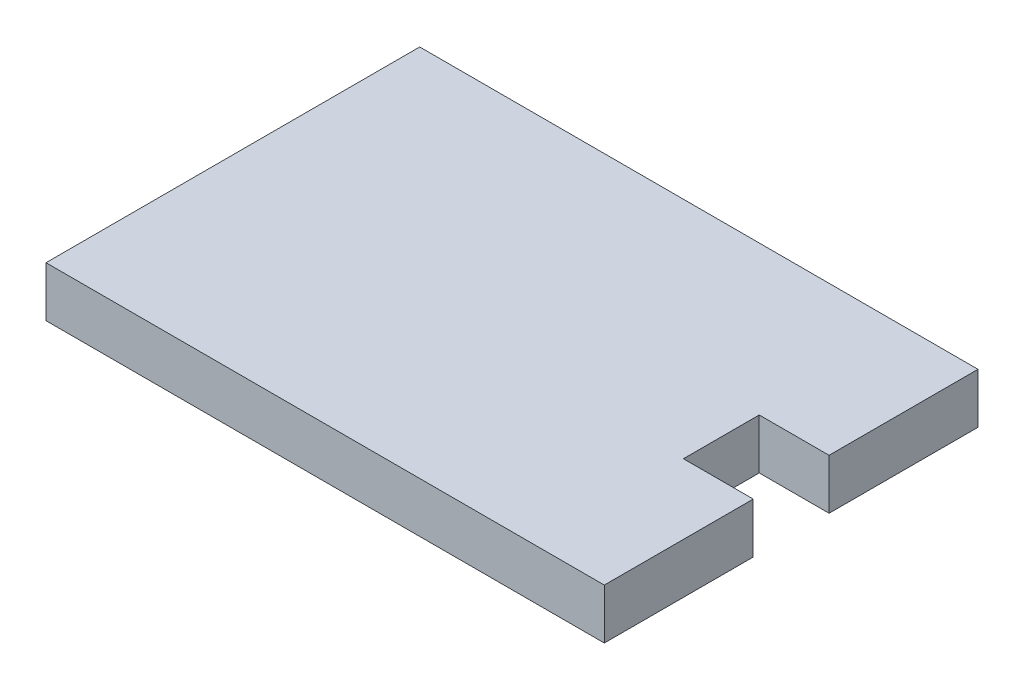
from build123d import *

# Parameters (mm, degrees)
EXTRUDE_1_DEPTH = 18


with BuildPart() as part:
    # 草图1 → 凸台-拉伸1 (new body)
    with BuildSketch(Plane(origin=(0, 0, 0), x_dir=(1, 0, 0), z_dir=(0, 1, 0))):
        Polygon((-100.04, 66.96), (100.04, 66.96), (100.04, 13.59), (75.01, 13.59), (75.01, -13.59), (100.04, -13.59), (100.04, -66.96), (-100.04, -66.96), align=None)
    extrude(amount=EXTRUDE_1_DEPTH)


solid = part.part
